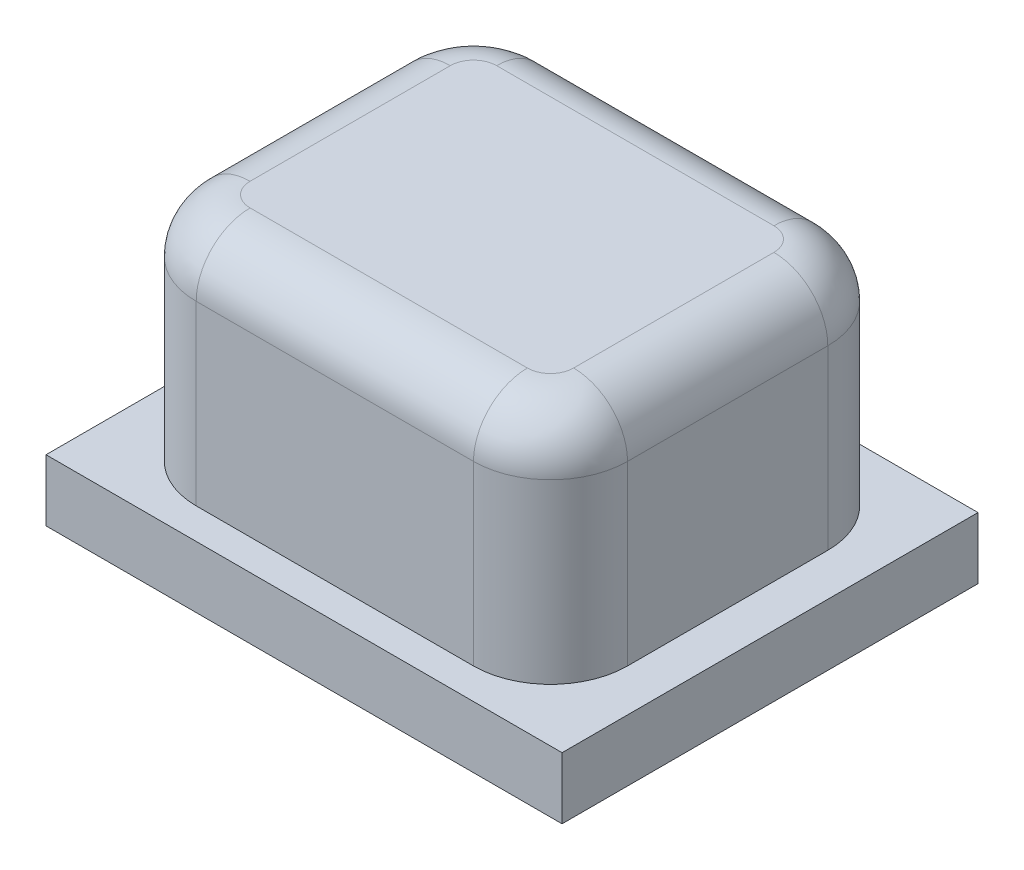
from build123d import *

# Parameters (mm, degrees)
EXTRUDE_335_DEPTH     = 3
SKETCH_2_W            = 6.7
SKETCH_2_H            = 5.4
EXTRUDE_569_DEPTH     = 0.8
SKETCH_3_W            = 3.6
SKETCH_3_H            = 3.6
CUT_EXTRUDE_834_DEPTH = 2.6
FILLET_1_R            = 0.7


with BuildPart() as part:
    # 草图1 → Extrude 335 (new body)
    with BuildSketch(Plane(origin=(0, 0, 0), x_dir=(1, 0, 0), z_dir=(0, 1, 0))):
        with BuildLine():
            Line((-1.8, -2.3), (1.8, -2.3))
            ThreePointArc((1.8, -2.3), (2.507106781, -2.007106781), (2.8, -1.3))
            Line((2.8, -1.3), (2.8, 1.3))
            ThreePointArc((2.8, 1.3), (2.507106781, 2.007106781), (1.8, 2.3))
            Line((1.8, 2.3), (-1.8, 2.3))
            ThreePointArc((-1.8, 2.3), (-2.507106781, 2.007106781), (-2.8, 1.3))
            Line((-2.8, 1.3), (-2.8, -1.3))
            ThreePointArc((-2.8, -1.3), (-2.507106781, -2.007106781), (-1.8, -2.3))
        make_face()
    extrude(amount=EXTRUDE_335_DEPTH)

    # 草图2 → Extrude 569 (add)
    with BuildSketch(Plane.XZ):
        Rectangle(SKETCH_2_W, SKETCH_2_H)
    extrude(amount=EXTRUDE_569_DEPTH)

    # 草图3 → Cut-Extrude 834 (cut)
    with BuildSketch(Plane.XZ.offset(0.8)):
        Rectangle(SKETCH_3_W, SKETCH_3_H)
    extrude(amount=-CUT_EXTRUDE_834_DEPTH, mode=Mode.SUBTRACT)

    # 圆角1
    fillet_1_edges = [part.edges().sort_by_distance(p)[0] for p in [
        (2.507106781, 3, -2.007106781),
        (0, 3, -2.3),
        (-2.507106781, 3, -2.007106781),
        (-2.8, 3, 0),
        (-2.507106781, 3, 2.007106781),
        (0, 3, 2.3),
        (2.507106781, 3, 2.007106781),
        (2.8, 3, 0),
    ]]
    fillet(fillet_1_edges, radius=FILLET_1_R)


solid = part.part
